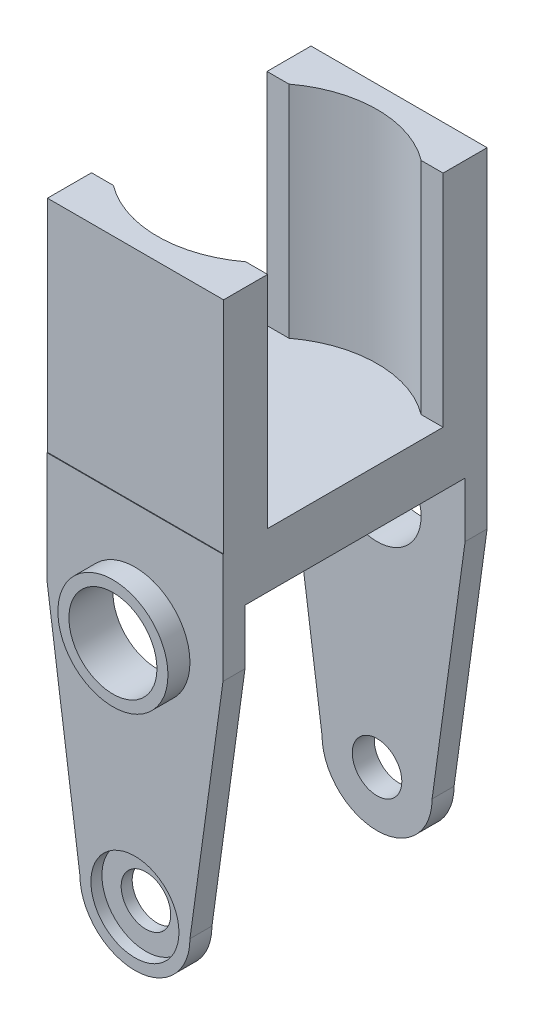
from build123d import *

# Parameters (mm, degrees)
SKETCH_4_R                   = 4
EXTRUDE_1_DEPTH              = 24
HOLE_WIZARD_M4_1_D           = 4.5
HOLE_WIZARD_M4_1_CBORE_D     = 8
HOLE_WIZARD_M4_1_CBORE_DEPTH = 1
EXTRUDE_2_DEPTH              = 2
EXTRUDE_2_DEPTH_BACK         = 26
SKETCH_7_R                   = 5
SKETCH_7_R_2                 = 4
EXTRUDE_3_DEPTH              = 20
CUT_EXTRUDE_1_DEPTH          = 20


with BuildPart() as part:
    # 草图4 → 凸台-拉伸1 (new body)
    with BuildSketch(Plane.XY):
        with BuildLine():
            Line((-8, 0), (-5, -21.75))
            ThreePointArc((-5, -21.75), (0, -26.75), (5, -21.75))
            Line((5, -21.75), (8, 0))
            Line((8, 0), (8, 10))
            Line((8, 10), (5, 10))
            Line((5, 10), (-5, 10))
            Line((-5, 10), (-8, 10))
            Line((-8, 10), (-8, 0))
        make_face()
        Circle(SKETCH_4_R, mode=Mode.SUBTRACT)
    extrude(amount=EXTRUDE_1_DEPTH)

    # M4 六角凹头盖的柱孔1 (through all)
    with Locations(Plane(origin=(0, -21.75, 24), x_dir=(1, 0, 0), z_dir=(0, 0, 1))):
        with Locations((0, 0)):
            CounterBoreHole(HOLE_WIZARD_M4_1_D / 2, HOLE_WIZARD_M4_1_CBORE_D / 2, HOLE_WIZARD_M4_1_CBORE_DEPTH)

    # 草图7 → 凸台-拉伸2 (add, two sides: drawn at the far end of the back side and taken through both)
    with BuildSketch(Plane.XY.offset(24).offset(-EXTRUDE_2_DEPTH_BACK)):
        Circle(SKETCH_7_R)
        Circle(SKETCH_7_R_2, mode=Mode.SUBTRACT)
    extrude(amount=EXTRUDE_2_DEPTH + EXTRUDE_2_DEPTH_BACK)

    # 草图8 → 凸台-拉伸3 (add)
    with BuildSketch(Plane(origin=(0, 10, 0), x_dir=(1, 0, 0), z_dir=(0, 1, 0))):
        with BuildLine():
            Line((-8, 0), (8, 0))
            Line((8, 0), (8, -4))
            Line((8, -4), (6.008972597, -4))
            ThreePointArc((6.008972597, -4), (0, -1.989201574), (-6.008972597, -4))
            Line((-6.008972597, -4), (-8, -4))
            Line((-8, -4), (-8, 0))
        make_face()
        with BuildLine():
            Line((8, -23.946124164), (8, -19.946124164))
            Line((8, -19.946124164), (6.008972597, -19.946124164))
            ThreePointArc((6.008972597, -19.946124164), (0, -21.956922589), (-6.008972597, -19.946124164))
            Line((-6.008972597, -19.946124164), (-8, -19.946124164))
            Line((-8, -19.946124164), (-8, -23.946124164))
            Line((-8, -23.946124164), (8, -23.946124164))
        make_face()
    extrude(amount=EXTRUDE_3_DEPTH)

    # 草图9 → 切除-拉伸1 (cut)
    with BuildSketch(Plane.ZY.offset(8)):
        Polygon((2, -27), (2, 0), (2, 5), (22, 5), (22, -27), align=None)
    extrude(amount=-CUT_EXTRUDE_1_DEPTH, mode=Mode.SUBTRACT)


solid = part.part
